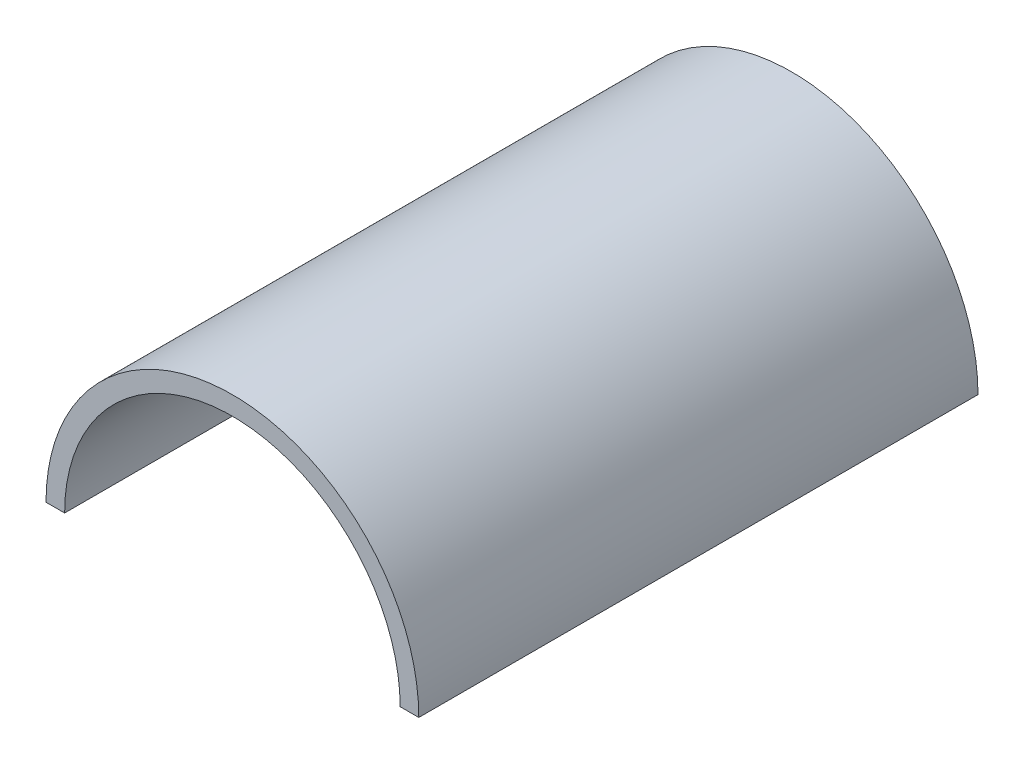
from build123d import *

# Parameters (mm, degrees)
ESBO_O1_R                = 20
ESBO_O1_R_2              = 18
RESSALTO_EXTRUS_O1_DEPTH = 60
ESBO_O2_W                = 40
ESBO_O2_H                = 60
CORTE_EXTRUS_O1_DEPTH    = 60


with BuildPart() as part:
    # Esboço1 → Ressalto-extrusão1 (new body)
    with BuildSketch(Plane.XY):
        Circle(ESBO_O1_R)
        Circle(ESBO_O1_R_2, mode=Mode.SUBTRACT)
    extrude(amount=RESSALTO_EXTRUS_O1_DEPTH)

    # Esboço2 → Corte-extrusão1 (cut)
    with BuildSketch(Plane(origin=(0, 0, 0), x_dir=(1, 0, 0), z_dir=(0, 1, 0))):
        with Locations((0, -30)):
            Rectangle(ESBO_O2_W, ESBO_O2_H)
    extrude(amount=-CORTE_EXTRUS_O1_DEPTH, mode=Mode.SUBTRACT)


solid = part.part
